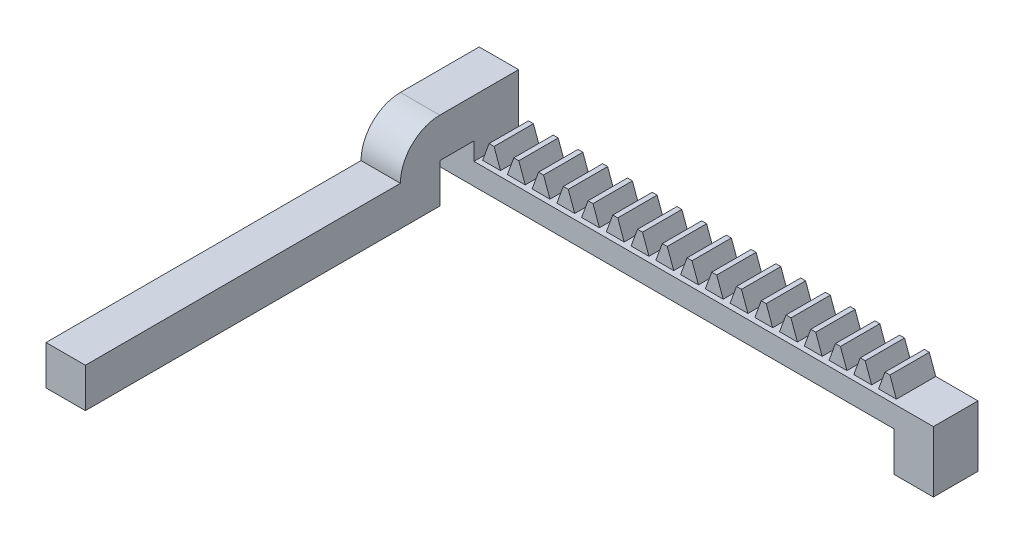
from build123d import *

# Parameters (mm, degrees)
BLANKSKE_W              = 80
BLANKSKE_H              = 7.5
BLANK_DEPTH             = 20
TOOTHCUTSIM_DEPTH       = 83.802475808
TEETHCUTS_COUNT         = 18
TEETHCUTS_PITCH         = 4.712388975
SKETCH1_W               = 20
SKETCH1_H               = 11.625
BOSS_EXTRUDE2_DEPTH     = 7.5
SKETCH3_W               = 20
SKETCH3_H               = 15
BOSS_EXTRUDE3_DEPTH     = 7.5
SKETCH4_W               = 7.5
SKETCH4_H               = 15
BOSS_EXTRUDE4_DEPTH     = 15
SKETCH8_W               = 7.5
SKETCH8_H               = 7.5
CUT_EXTRUDE1_DEPTH      = 15
CUT_EXTRUDE2_DEPTH      = 15
SKETCH10_W              = 7.5
SKETCH10_H              = 7.5
BOSS_EXTRUDE5_DEPTH     = 7.5
SKETCH11_W              = 7.5
SKETCH11_H              = 15
BOSS_EXTRUDE7_DEPTH     = 60
CUT_EXTRUDE4_DEPTH      = 116.829144109
CUT_EXTRUDE4_DEPTH_BACK = 116.829144109
SKETCH12_W              = 95
SKETCH12_H              = 10
SKETCH14_W              = 95
SKETCH14_H              = 2.5
CUT_EXTRUDE5_DEPTH      = 100
SKETCH15_W              = 67.5
SKETCH15_H              = 7.5
CUT_EXTRUDE6_DEPTH      = 122.963109177
BOSS_EXTRUDE8_DEPTH     = 7.5
BOSS_EXTRUDE9_DEPTH     = 1


with BuildPart() as part:
    # BlankSke → Blank (new body)
    with BuildSketch(Plane.XY):
        with Locations((40, 3.75)):
            Rectangle(BLANKSKE_W, BLANKSKE_H)
    extrude(amount=-BLANK_DEPTH)

    # TooCutSkeSim → ToothCutSim (cut, through all)
    with BuildSketch(Plane.XY):
        Polygon((0.654653055, 4.125), (-0.654653055, 4.125), (-1.892297439, 7.5254), (1.892297439, 7.5254), align=None)
    toothcutsim = extrude(amount=-TOOTHCUTSIM_DEPTH, mode=Mode.SUBTRACT)

    # TeethCuts: ToothCutSim ×18
    with Locations(*[(i * TEETHCUTS_PITCH, 0, 0) for i in range(1, TEETHCUTS_COUNT)]):
        add(toothcutsim, mode=Mode.SUBTRACT)

    # Sketch1 → Boss-Extrude2 (add)
    with BuildSketch(Plane(origin=(80, 0, 0), x_dir=(0, 0, -1), z_dir=(1, 0, 0))):
        with Locations((10, -1.6875)):
            Rectangle(SKETCH1_W, SKETCH1_H)
    extrude(amount=BOSS_EXTRUDE2_DEPTH)

    # Sketch3 → Boss-Extrude3 (add)
    with BuildSketch(Plane.ZY):
        with Locations((-10, 7.5)):
            Rectangle(SKETCH3_W, SKETCH3_H)
    extrude(amount=BOSS_EXTRUDE3_DEPTH)

    # Sketch4 → Boss-Extrude4 (add)
    with BuildSketch(Plane.XY):
        with Locations((-3.75, 7.5)):
            Rectangle(SKETCH4_W, SKETCH4_H)
    extrude(amount=BOSS_EXTRUDE4_DEPTH)

    # Sketch8 → Cut-Extrude1 (cut)
    with BuildSketch(Plane(origin=(0, 0, 0), x_dir=(0, 0, -1), z_dir=(1, 0, 0))):
        with Locations((-3.75, 3.75)):
            Rectangle(SKETCH8_W, SKETCH8_H)
    extrude(amount=-CUT_EXTRUDE1_DEPTH, mode=Mode.SUBTRACT)

    # Sketch9 → Cut-Extrude2 (cut)
    with BuildSketch(Plane.ZY.offset(7.5)):
        Polygon((7.5, 15), (15, 7.5), (15, 15), align=None)
    extrude(amount=-CUT_EXTRUDE2_DEPTH, mode=Mode.SUBTRACT)

    # Sketch10 → Boss-Extrude5 (add)
    with BuildSketch(Plane.XZ):
        with Locations((-3.75, 11.25)):
            Rectangle(SKETCH10_W, SKETCH10_H)
    extrude(amount=BOSS_EXTRUDE5_DEPTH)

    # Sketch11 → Boss-Extrude7 (add)
    with BuildSketch(Plane.XY.offset(15)):
        with Locations((-3.75, 0)):
            Rectangle(SKETCH11_W, SKETCH11_H)
    extrude(amount=BOSS_EXTRUDE7_DEPTH)

    # Sketch12 → Cut-Extrude4 (cut, two sides: drawn at the far end of the back side and taken through both)
    with BuildSketch(Plane(origin=(0, 4.125, 0), x_dir=(1, 0, 0), z_dir=(0, 1, 0)).offset(-CUT_EXTRUDE4_DEPTH_BACK)):
        with Locations((40, 15)):
            Rectangle(SKETCH12_W, SKETCH12_H)
    extrude(amount=CUT_EXTRUDE4_DEPTH + CUT_EXTRUDE4_DEPTH_BACK, mode=Mode.SUBTRACT)

    # Sketch14 → Cut-Extrude5 (cut)
    with BuildSketch(Plane(origin=(0, 15, 0), x_dir=(1, 0, 0), z_dir=(0, 1, 0))):
        with Locations((40, 8.75)):
            Rectangle(SKETCH14_W, SKETCH14_H)
    extrude(amount=-CUT_EXTRUDE5_DEPTH, mode=Mode.SUBTRACT)

    # Sketch15 → Cut-Extrude6 (cut, through all)
    with BuildSketch(Plane.ZY.offset(7.5)):
        with Locations((41.25, -3.75)):
            Rectangle(SKETCH15_W, SKETCH15_H)
    extrude(amount=-CUT_EXTRUDE6_DEPTH, mode=Mode.SUBTRACT)

    # Sketch16 → Boss-Extrude8 (add)
    with BuildSketch(Plane.ZY.offset(7.5)):
        with BuildLine():
            Line((7.5, 7.5), (7.5, 15))
            ThreePointArc((7.5, 15), (12.803300859, 12.803300859), (15, 7.5))
            Line((15, 7.5), (7.5, 7.5))
        make_face()
    extrude(amount=-BOSS_EXTRUDE8_DEPTH)

    # Sketch19 → Boss-Extrude9 (add)
    with BuildSketch(Plane.XY):
        Polygon((-7.5, 0), (-7.5, 7.5), (0, 7.5), (0, 4.125), (87.5, 4.125), (87.5, -7.5), (80, -7.5), (80, 0), align=None)
    extrude(amount=BOSS_EXTRUDE9_DEPTH)


solid = part.part
